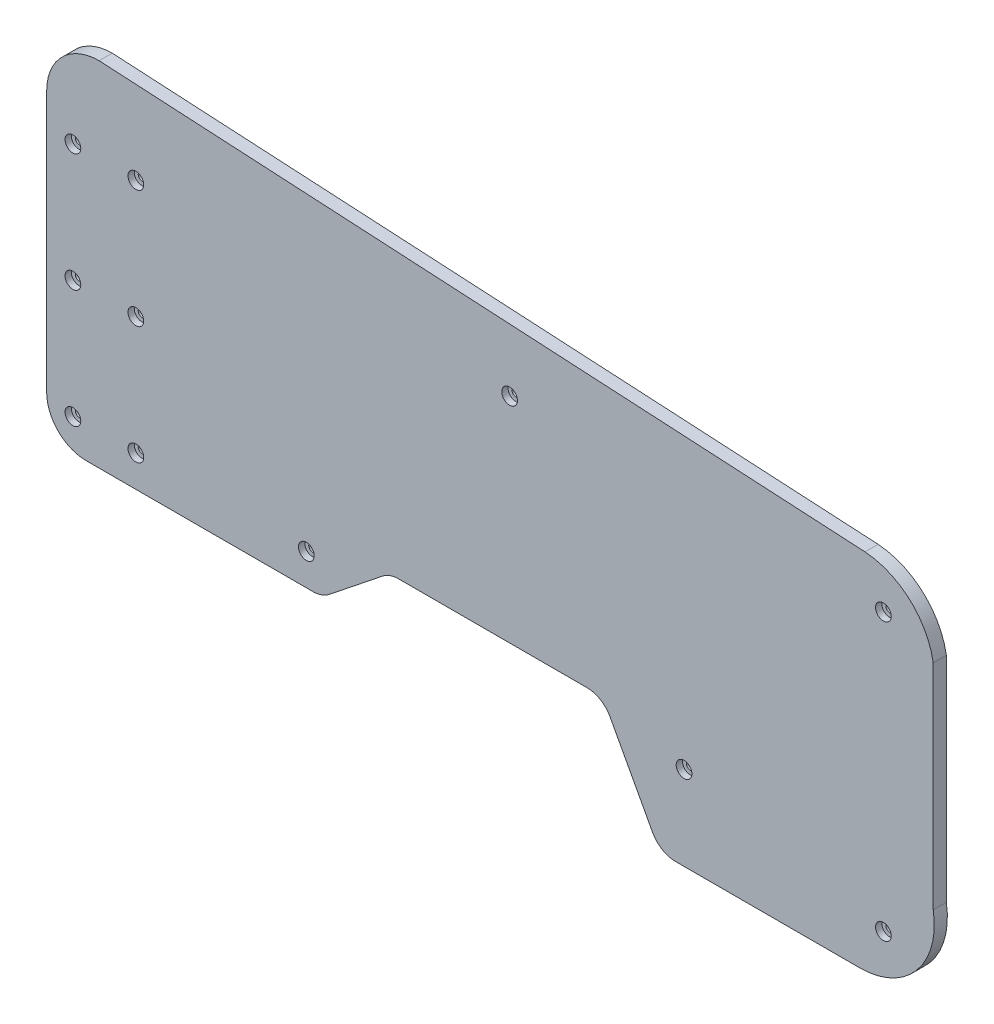
from build123d import *

# Parameters (mm, degrees)
DODANIE_WYCI_GNI_CIE1_DEPTH = 5
SZKIC1_R                    = 3.5
WYTNIJ_WYCI_GNI_CIE1_DEPTH  = 100
SZKIC3_R                    = 1.5
WYTNIJ_WYCI_GNI_CIE3_DEPTH  = 5
SZKIC5_R                    = 3
WYTNIJ_WYCI_GNI_CIE4_DEPTH  = 2.4


with BuildPart() as part:
    # outer-wire → Dodanie-wyciągnięcie1 (new body)
    with BuildSketch(Plane.XY):
        with BuildLine():
            Line((-24, -24.53020641), (62.5, -24.53020641))
            ThreePointArc((62.5, -24.53020641), (65.803504247, -23.968789974), (68.736080178, -22.347578348))
            Line((68.736080178, -22.347578348), (89, -6.182628062))
            ThreePointArc((89, -6.182628062), (91.932575931, -4.561416436), (95.236080178, -4))
            Line((95.236080178, -4), (167, -4))
            ThreePointArc((167, -4), (172.310885546, -5.526836794), (176, -9.641101056))
            Line((176, -9.641101056), (192, -39.280484771))
            ThreePointArc((192, -39.280484771), (195.676368139, -43.118069462), (200.799707694, -44.53020641))
            Line((200.799707694, -44.53020641), (271, -44.53020641))
            ThreePointArc((271, -44.53020641), (292.697243682, -34.454979346), (299, -11.3778078))
            Line((299, -11.3778078), (299, 70.236479581))
            ThreePointArc((299, 70.236479581), (290.082226047, 86.530998263), (273, 93.827270232))
            Line((273, 93.827270232), (-19, 110))
            ThreePointArc((-19, 110), (-33.142135624, 104.142135624), (-39, 90))
            Line((-39, 90), (-39, -9.53020641))
            ThreePointArc((-39, -9.53020641), (-34.606601718, -20.136808128), (-24, -24.53020641))
        make_face()
    extrude(amount=DODANIE_WYCI_GNI_CIE1_DEPTH)

    # Szkic1 → Wytnij-wyciągnięcie1 (cut)
    with BuildSketch(Plane(origin=(0, -24.53020641, 0), x_dir=(-1, 0, 0), z_dir=(0, -1, 0))):
        with Locations((19, 0)):
            Circle(SZKIC1_R)
    extrude(amount=-WYTNIJ_WYCI_GNI_CIE1_DEPTH, mode=Mode.SUBTRACT)

    # Szkic3 → Wytnij-wyciągnięcie3 (cut)
    with BuildSketch(Plane.XY.offset(5)):
        with Locations((280, -28)):
            Circle(SZKIC3_R)
        with Locations((280, 77.5)):
            Circle(SZKIC3_R)
        with Locations((-5, 77.5)):
            Circle(SZKIC3_R)
        with Locations((-29, 77.5)):
            Circle(SZKIC3_R)
        with Locations((-29, -12.5)):
            Circle(SZKIC3_R)
        with Locations((-29, 32.5)):
            Circle(SZKIC3_R)
        with Locations((-5, 32.5)):
            Circle(SZKIC3_R)
        with Locations((-5, -12.5)):
            Circle(SZKIC3_R)
        with Locations((60, -12.5)):
            Circle(SZKIC3_R)
        with Locations((204, -12.5)):
            Circle(SZKIC3_R)
        with Locations((137.5, 77.5)):
            Circle(SZKIC3_R)
    extrude(amount=-WYTNIJ_WYCI_GNI_CIE3_DEPTH, mode=Mode.SUBTRACT)

    # Szkic5 → Wytnij-wyciągnięcie4 (cut)
    with BuildSketch(Plane.XY.offset(5)):
        with Locations((-29, -12.5)):
            Circle(SZKIC5_R)
        with Locations((-29, 32.5)):
            Circle(SZKIC5_R)
        with Locations((-29, 77.5)):
            Circle(SZKIC5_R)
        with Locations((-5, 77.5)):
            Circle(SZKIC5_R)
        with Locations((-5, 32.5)):
            Circle(SZKIC5_R)
        with Locations((-5, -12.5)):
            Circle(SZKIC5_R)
        with Locations((60, -12.5)):
            Circle(SZKIC5_R)
        with Locations((137.5, 77.5)):
            Circle(SZKIC5_R)
        with Locations((204, -12.5)):
            Circle(SZKIC5_R)
        with Locations((280, -28)):
            Circle(SZKIC5_R)
        with Locations((280, 77.5)):
            Circle(SZKIC5_R)
    extrude(amount=-WYTNIJ_WYCI_GNI_CIE4_DEPTH, mode=Mode.SUBTRACT)


with BuildPart() as body_2:
    # Lustro4: mirrored copy
    add(part.part.mirror(Plane.XY.offset(5)))


with BuildPart() as body_2_2:
    # Lustro5: mirrored copy
    add(body_2.part.mirror(Plane(origin=(-24, -9.53020641, 10), x_dir=(1, 0, 0), z_dir=(0, 0, -1))))


with BuildPart() as body_2_3:
    # Lustro6: mirrored copy
    add(body_2_2.part.mirror(Plane(origin=(-24, -9.53020641, 10), x_dir=(1, 0, 0), z_dir=(0, 0, 1))))


with BuildPart() as body_2_4:
    # Lustro7: mirrored copy
    add(body_2_3.part.mirror(Plane(origin=(-24, -9.53020641, 10), x_dir=(1, 0, 0), z_dir=(0, 0, -1))))


solid = body_2_4.part
